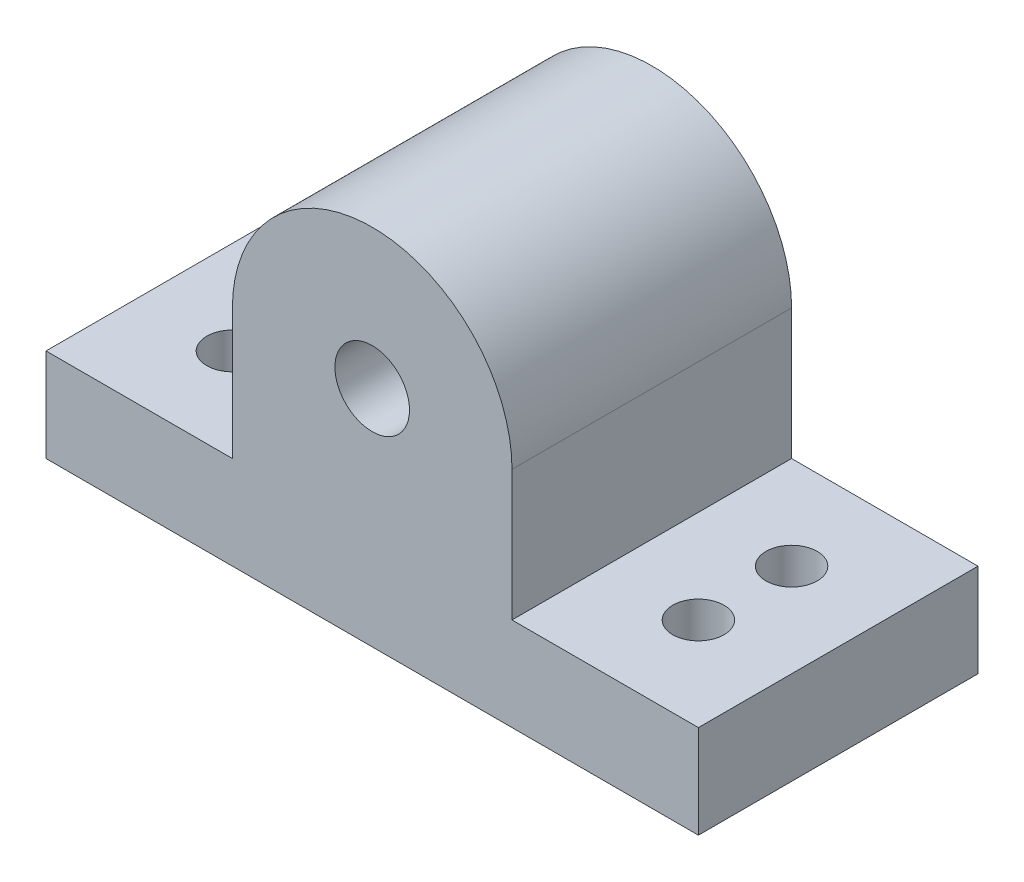
from build123d import *

# Parameters (mm, degrees)
SKETCH1_R           = 2
BOSS_EXTRUDE1_DEPTH = 15
SKETCH8_W           = 15
SKETCH8_H           = 5
BOSS_EXTRUDE6_DEPTH = 10
SKETCH9_W           = 15
SKETCH9_H           = 5
BOSS_EXTRUDE7_DEPTH = 10
SKETCH10_R          = 1.375
CUT_EXTRUDE1_DEPTH  = 32.753503892


with BuildPart() as part:
    # Sketch1 → Boss-Extrude1 (new body)
    with BuildSketch(Plane.XY):
        with BuildLine():
            Line((-13.938149665, -41.724647752), (-13.938149665, -53.724647752))
            Line((-13.938149665, -53.724647752), (1.061850335, -53.724647752))
            Line((1.061850335, -53.724647752), (1.061850335, -41.724647752))
            ThreePointArc((1.061850335, -41.724647752), (-6.438149665, -34.224647752), (-13.938149665, -41.724647752))
        make_face()
        with Locations((-6.438149665, -41.724647752)):
            Circle(SKETCH1_R, mode=Mode.SUBTRACT)
    extrude(amount=BOSS_EXTRUDE1_DEPTH)

    # Sketch8 → Boss-Extrude6 (add)
    with BuildSketch(Plane.ZY.offset(13.938149665)):
        with Locations((7.5, -51.224647752)):
            Rectangle(SKETCH8_W, SKETCH8_H)
    extrude(amount=BOSS_EXTRUDE6_DEPTH)

    # Sketch9 → Boss-Extrude7 (add)
    with BuildSketch(Plane(origin=(1.061850335, 0, 0), x_dir=(0, 0, -1), z_dir=(1, 0, 0))):
        with Locations((-7.5, -51.224647752)):
            Rectangle(SKETCH9_W, SKETCH9_H)
    extrude(amount=BOSS_EXTRUDE7_DEPTH)

    # Sketch10 → Cut-Extrude1 (cut, through all)
    with BuildSketch(Plane(origin=(0, -48.724647752, 0), x_dir=(1, 0, 0), z_dir=(0, 1, 0))):
        with Locations(Location((6.061850335, -10, 0), (0, 0, 270))):
            Circle(SKETCH10_R)
        with Locations(Location((6.061850335, -5, 0), (0, 0, 270))):
            Circle(SKETCH10_R)
        with Locations(Location((-18.938149665, -10, 0), (0, 0, 270))):
            Circle(SKETCH10_R)
        with Locations(Location((-18.938149665, -5, 0), (0, 0, 270))):
            Circle(SKETCH10_R)
    extrude(amount=-CUT_EXTRUDE1_DEPTH, mode=Mode.SUBTRACT)


solid = part.part
